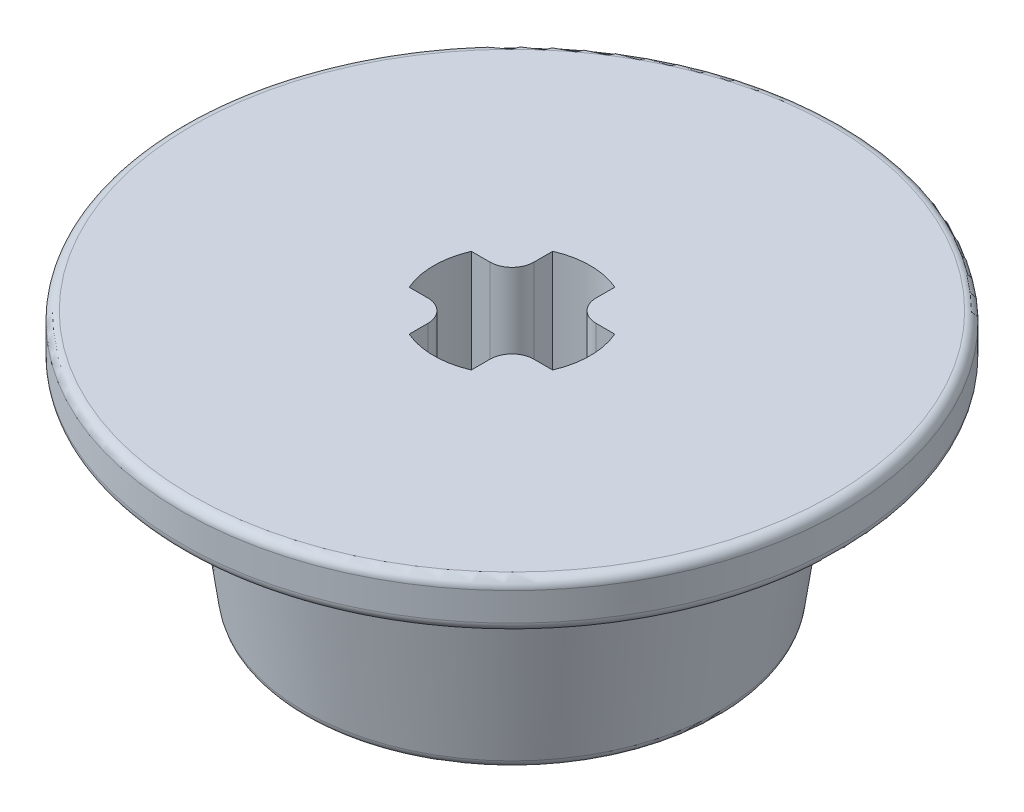
from build123d import *

# Parameters (mm, degrees)
CUT_EXTRUDE1_DEPTH = 17.867127793
FILLET1_R          = 0.7
FILLET2_R          = 0.3


with BuildPart() as part:
    # Sketch2 → Revolve1 (revolve)
    with BuildSketch(Plane.XY, mode=Mode.PRIVATE) as revolve1_sk:
        Polygon((0, 0), (10.5, 0), (10.5, -1.5), (7.5, -1.5), (6.586484574, -8), (0, -8), align=None)
    revolve(revolve1_sk.sketch.rotate(Axis((0, 0, 0), (0, 1, 0)), 90), axis=Axis((0, 0, 0), (0, 1, 0)))

    # Sketch1 → Cut-Extrude1 (cut, through all)
    with BuildSketch(Plane(origin=(0, 0, 0), x_dir=(1, 0, 0), z_dir=(0, 1, 0))):
        with BuildLine():
            Line((-0.99, 0.99), (-2.284731932, 0.99))
            ThreePointArc((-2.284731932, 0.99), (-2.49, 0), (-2.284731932, -0.99))
            Line((-2.284731932, -0.99), (-0.99, -0.99))
            Line((-0.99, -0.99), (-0.99, -2.284731932))
            ThreePointArc((-0.99, -2.284731932), (0, -2.49), (0.99, -2.284731932))
            Line((0.99, -2.284731932), (0.99, -0.99))
            Line((0.99, -0.99), (2.284249826, -0.99))
            ThreePointArc((2.284249826, -0.99), (2.489557645, 0), (2.284249826, 0.99))
            Line((2.284249826, 0.99), (0.99, 0.99))
            Line((0.99, 0.99), (0.99, 2.28753254))
            ThreePointArc((0.99, 2.28753254), (0, 2.492569984), (-0.99, 2.28753254))
            Line((-0.99, 2.28753254), (-0.99, 0.99))
        make_face()
    extrude(amount=-CUT_EXTRUDE1_DEPTH, mode=Mode.SUBTRACT)

    # Fillet1
    fillet1_edges = [part.edges().sort_by_distance(p)[0] for p in [
        (-0.99, -4, -0.99),
        (0.99, -4, -0.99),
        (0.99, -4, 0.99),
        (-0.99, -4, 0.99),
    ]]
    fillet(fillet1_edges, radius=FILLET1_R)

    # Fillet2
    fillet2_edges = [part.edges().sort_by_distance(p)[0] for p in [
        (0, -8, 6.586484574),
        (0, -1.5, 7.5),
        (0, -1.5, 10.5),
        (0, 0, 10.5),
    ]]
    fillet(fillet2_edges, radius=FILLET2_R)


solid = part.part
